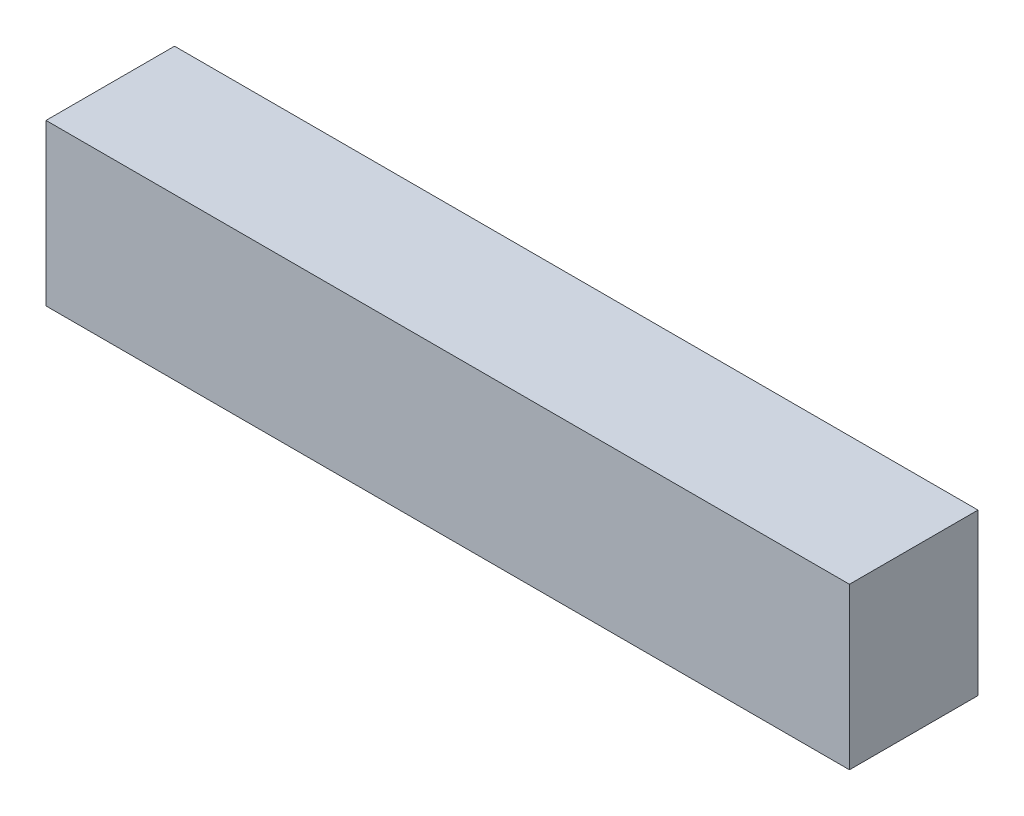
from build123d import *

# Parameters (mm, degrees)
SKETCH1_W           = 50
SKETCH1_H           = 10
SKETCH1_R           = 1.5
BOSS_EXTRUDE2_DEPTH = 6
SKETCH2_W           = 50
SKETCH2_H           = 10
BOSS_EXTRUDE3_DEPTH = 2


with BuildPart() as part:
    # Sketch1 → Boss-Extrude2 (new body)
    with BuildSketch(Plane.XY):
        with Locations((25, 5)):
            Rectangle(SKETCH1_W, SKETCH1_H)
        with Locations((5.5, 5)):
            Circle(SKETCH1_R, mode=Mode.SUBTRACT)
        with Locations(Location((44.5, 5, 0), (0, 0, 180))):
            Circle(SKETCH1_R, mode=Mode.SUBTRACT)
    extrude(amount=BOSS_EXTRUDE2_DEPTH)

    # Sketch2 → Boss-Extrude3 (add)
    with BuildSketch(Plane.XY.offset(6)):
        with Locations((25, 5)):
            Rectangle(SKETCH2_W, SKETCH2_H)
    extrude(amount=BOSS_EXTRUDE3_DEPTH)


solid = part.part
